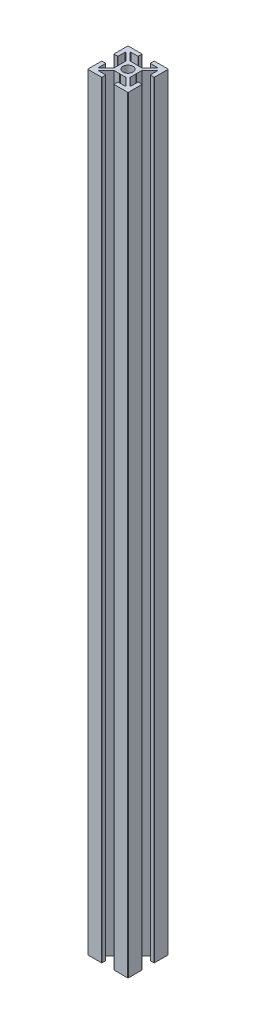
from build123d import *

# Parameters (mm, degrees)
SKETCH1_R           = 2.5
BOSS_EXTRUDE1_DEPTH = 380


with BuildPart() as part:
    # Sketch1 → Boss-Extrude1 (new body)
    with BuildSketch(Plane(origin=(0, 0, 0), x_dir=(1, 0, 0), z_dir=(0, 1, 0))):
        with BuildLine():
            Line((-2.997918472, 4.058578644), (-6.597918472, 7.658578644))
            ThreePointArc((-6.597918472, 7.658578644), (-6.621415508, 7.686854412), (-6.639339828, 7.718953455))
            ThreePointArc((-6.639339828, 7.718953455), (-6.656497116, 7.8), (-6.639339828, 7.881046545))
            ThreePointArc((-6.639339828, 7.881046545), (-6.565562901, 7.967644429), (-6.456497116, 8))
            Line((-6.456497116, 8), (-3.2, 8))
            ThreePointArc((-3.2, 8), (-3.058578644, 8.058578644), (-3, 8.2))
            Line((-3, 8.2), (-3, 9.8))
            ThreePointArc((-3, 9.8), (-3.058578644, 9.941421356), (-3.2, 10))
            Line((-3.2, 10), (-9.8, 10))
            ThreePointArc((-9.8, 10), (-9.941421356, 9.941421356), (-10, 9.8))
            Line((-10, 9.8), (-10, 3.2))
            ThreePointArc((-10, 3.2), (-9.941421356, 3.058578644), (-9.8, 3))
            Line((-9.8, 3), (-8.2, 3))
            ThreePointArc((-8.2, 3), (-8.058578644, 3.058578644), (-8, 3.2))
            Line((-8, 3.2), (-8, 6.456497116))
            ThreePointArc((-8, 6.456497116), (-7.967644429, 6.565562901), (-7.881046545, 6.639339828))
            ThreePointArc((-7.881046545, 6.639339828), (-7.8, 6.656497116), (-7.718953455, 6.639339828))
            ThreePointArc((-7.718953455, 6.639339828), (-7.686854412, 6.621415508), (-7.658578644, 6.597918472))
            Line((-7.658578644, 6.597918472), (-4.058578644, 2.997918472))
            ThreePointArc((-4.058578644, 2.997918472), (-4.015224093, 2.933033802), (-4, 2.856497116))
            Line((-4, 2.856497116), (-4, 0.130901699))
            ThreePointArc((-4, 0.130901699), (-3.99253254, 0.104615144), (-3.97236068, 0.08618034))
            Line((-3.97236068, 0.08618034), (-3.8, 0))
            Line((-3.8, 0), (-3.97236068, -0.08618034))
            ThreePointArc((-3.97236068, -0.08618034), (-3.99253254, -0.104615144), (-4, -0.130901699))
            Line((-4, -0.130901699), (-4, -2.856497116))
            ThreePointArc((-4, -2.856497116), (-4.015224093, -2.933033802), (-4.058578644, -2.997918472))
            Line((-4.058578644, -2.997918472), (-7.658578644, -6.597918472))
            ThreePointArc((-7.658578644, -6.597918472), (-7.686854412, -6.621415508), (-7.718953455, -6.639339828))
            ThreePointArc((-7.718953455, -6.639339828), (-7.8, -6.656497116), (-7.881046545, -6.639339828))
            ThreePointArc((-7.881046545, -6.639339828), (-7.967644429, -6.565562901), (-8, -6.456497116))
            Line((-8, -6.456497116), (-8, -3.2))
            ThreePointArc((-8, -3.2), (-8.058578644, -3.058578644), (-8.2, -3))
            Line((-8.2, -3), (-9.8, -3))
            ThreePointArc((-9.8, -3), (-9.941421356, -3.058578644), (-10, -3.2))
            Line((-10, -3.2), (-10, -9.8))
            ThreePointArc((-10, -9.8), (-9.941421356, -9.941421356), (-9.8, -10))
            Line((-9.8, -10), (-3.2, -10))
            ThreePointArc((-3.2, -10), (-3.058578644, -9.941421356), (-3, -9.8))
            Line((-3, -9.8), (-3, -8.2))
            ThreePointArc((-3, -8.2), (-3.058578644, -8.058578644), (-3.2, -8))
            Line((-3.2, -8), (-6.456497116, -8))
            ThreePointArc((-6.456497116, -8), (-6.565562901, -7.967644429), (-6.639339828, -7.881046545))
            ThreePointArc((-6.639339828, -7.881046545), (-6.656497116, -7.8), (-6.639339828, -7.718953455))
            ThreePointArc((-6.639339828, -7.718953455), (-6.621415508, -7.686854412), (-6.597918472, -7.658578644))
            Line((-6.597918472, -7.658578644), (-2.997918472, -4.058578644))
            ThreePointArc((-2.997918472, -4.058578644), (-2.933033802, -4.015224093), (-2.856497116, -4))
            Line((-2.856497116, -4), (-0.211803399, -4))
            ThreePointArc((-0.211803399, -4), (-0.200315753, -3.998662449), (-0.189442719, -3.99472136))
            Line((-0.189442719, -3.99472136), (0, -3.9))
            Line((0, -3.9), (0.189442719, -3.99472136))
            ThreePointArc((0.189442719, -3.99472136), (0.200315753, -3.998662449), (0.211803399, -4))
            Line((0.211803399, -4), (2.856497116, -4))
            ThreePointArc((2.856497116, -4), (2.933033802, -4.015224093), (2.997918472, -4.058578644))
            Line((2.997918472, -4.058578644), (6.597918472, -7.658578644))
            ThreePointArc((6.597918472, -7.658578644), (6.621415508, -7.686854412), (6.639339828, -7.718953455))
            ThreePointArc((6.639339828, -7.718953455), (6.656497116, -7.8), (6.639339828, -7.881046545))
            ThreePointArc((6.639339828, -7.881046545), (6.565562901, -7.967644429), (6.456497116, -8))
            Line((6.456497116, -8), (3.2, -8))
            ThreePointArc((3.2, -8), (3.058578644, -8.058578644), (3, -8.2))
            Line((3, -8.2), (3, -9.8))
            ThreePointArc((3, -9.8), (3.058578644, -9.941421356), (3.2, -10))
            Line((3.2, -10), (9.8, -10))
            ThreePointArc((9.8, -10), (9.941421356, -9.941421356), (10, -9.8))
            Line((10, -9.8), (10, -3.2))
            ThreePointArc((10, -3.2), (9.941421356, -3.058578644), (9.8, -3))
            Line((9.8, -3), (8.2, -3))
            ThreePointArc((8.2, -3), (8.058578644, -3.058578644), (8, -3.2))
            Line((8, -3.2), (8, -6.456497116))
            ThreePointArc((8, -6.456497116), (7.967644429, -6.565562901), (7.881046545, -6.639339828))
            ThreePointArc((7.881046545, -6.639339828), (7.8, -6.656497116), (7.718953455, -6.639339828))
            ThreePointArc((7.718953455, -6.639339828), (7.686854412, -6.621415508), (7.658578644, -6.597918472))
            Line((7.658578644, -6.597918472), (4.058578644, -2.997918472))
            ThreePointArc((4.058578644, -2.997918472), (4.015224093, -2.933033802), (4, -2.856497116))
            Line((4, -2.856497116), (4, -0.130901699))
            ThreePointArc((4, -0.130901699), (3.99253254, -0.104615144), (3.97236068, -0.08618034))
            Line((3.97236068, -0.08618034), (3.8, 0))
            Line((3.8, 0), (3.97236068, 0.08618034))
            ThreePointArc((3.97236068, 0.08618034), (3.99253254, 0.104615144), (4, 0.130901699))
            Line((4, 0.130901699), (4, 2.856497116))
            ThreePointArc((4, 2.856497116), (4.015224093, 2.933033802), (4.058578644, 2.997918472))
            Line((4.058578644, 2.997918472), (7.658578644, 6.597918472))
            ThreePointArc((7.658578644, 6.597918472), (7.686854412, 6.621415508), (7.718953455, 6.639339828))
            ThreePointArc((7.718953455, 6.639339828), (7.8, 6.656497116), (7.881046545, 6.639339828))
            ThreePointArc((7.881046545, 6.639339828), (7.967644429, 6.565562901), (8, 6.456497116))
            Line((8, 6.456497116), (8, 3.2))
            ThreePointArc((8, 3.2), (8.058578644, 3.058578644), (8.2, 3))
            Line((8.2, 3), (9.8, 3))
            ThreePointArc((9.8, 3), (9.941421356, 3.058578644), (10, 3.2))
            Line((10, 3.2), (10, 9.8))
            ThreePointArc((10, 9.8), (9.941421356, 9.941421356), (9.8, 10))
            Line((9.8, 10), (3.2, 10))
            ThreePointArc((3.2, 10), (3.058578644, 9.941421356), (3, 9.8))
            Line((3, 9.8), (3, 8.2))
            ThreePointArc((3, 8.2), (3.058578644, 8.058578644), (3.2, 8))
            Line((3.2, 8), (6.456497116, 8))
            ThreePointArc((6.456497116, 8), (6.565562901, 7.967644429), (6.639339828, 7.881046545))
            ThreePointArc((6.639339828, 7.881046545), (6.656497116, 7.8), (6.639339828, 7.718953455))
            ThreePointArc((6.639339828, 7.718953455), (6.621415508, 7.686854412), (6.597918472, 7.658578644))
            Line((6.597918472, 7.658578644), (2.997918472, 4.058578644))
            ThreePointArc((2.997918472, 4.058578644), (2.933033802, 4.015224093), (2.856497116, 4))
            Line((2.856497116, 4), (0.211803399, 4))
            ThreePointArc((0.211803399, 4), (0.200315753, 3.998662449), (0.189442719, 3.99472136))
            Line((0.189442719, 3.99472136), (0, 3.9))
            Line((0, 3.9), (-0.189442719, 3.99472136))
            ThreePointArc((-0.189442719, 3.99472136), (-0.200315753, 3.998662449), (-0.211803399, 4))
            Line((-0.211803399, 4), (-2.856497116, 4))
            ThreePointArc((-2.856497116, 4), (-2.933033802, 4.015224093), (-2.997918472, 4.058578644))
        make_face()
        Circle(SKETCH1_R, mode=Mode.SUBTRACT)
    extrude(amount=BOSS_EXTRUDE1_DEPTH)


solid = part.part
